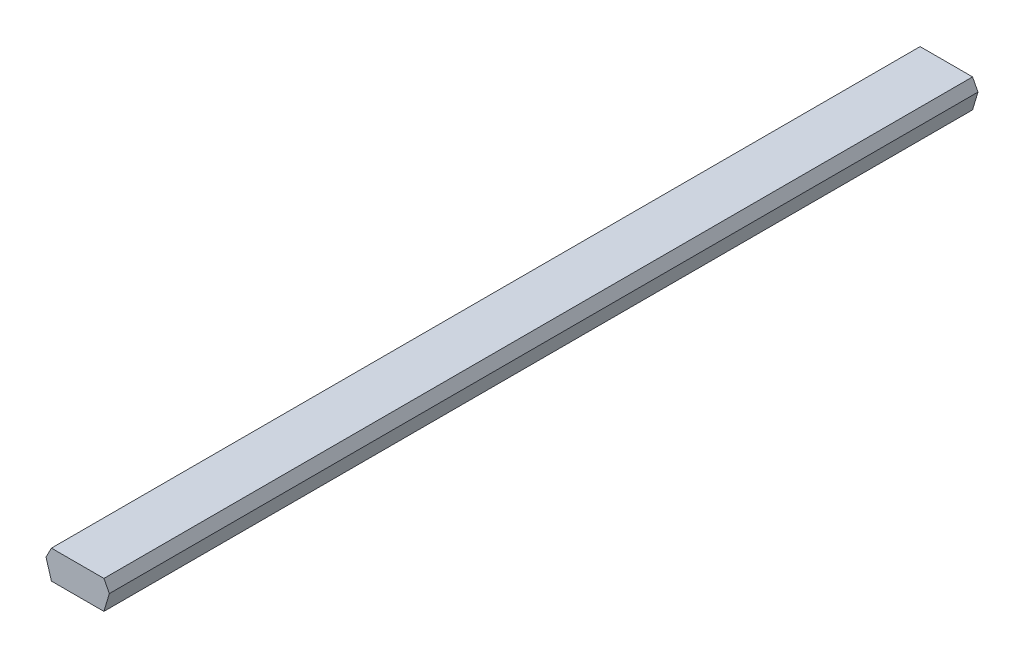
from build123d import *

# Parameters (mm, degrees)
BOSS_EXTRUDE1_DEPTH = 1219.2


with BuildPart() as part:
    # Sketch1 → Boss-Extrude1 (new body)
    with BuildSketch(Plane.XY):
        Polygon((-36.83, -20.066), (-44.45, 5.419645505), (-36.83, 20.066), (36.83, 20.066), (44.45, 5.419645505), (36.83, -20.066), align=None)
    extrude(amount=BOSS_EXTRUDE1_DEPTH)


solid = part.part
